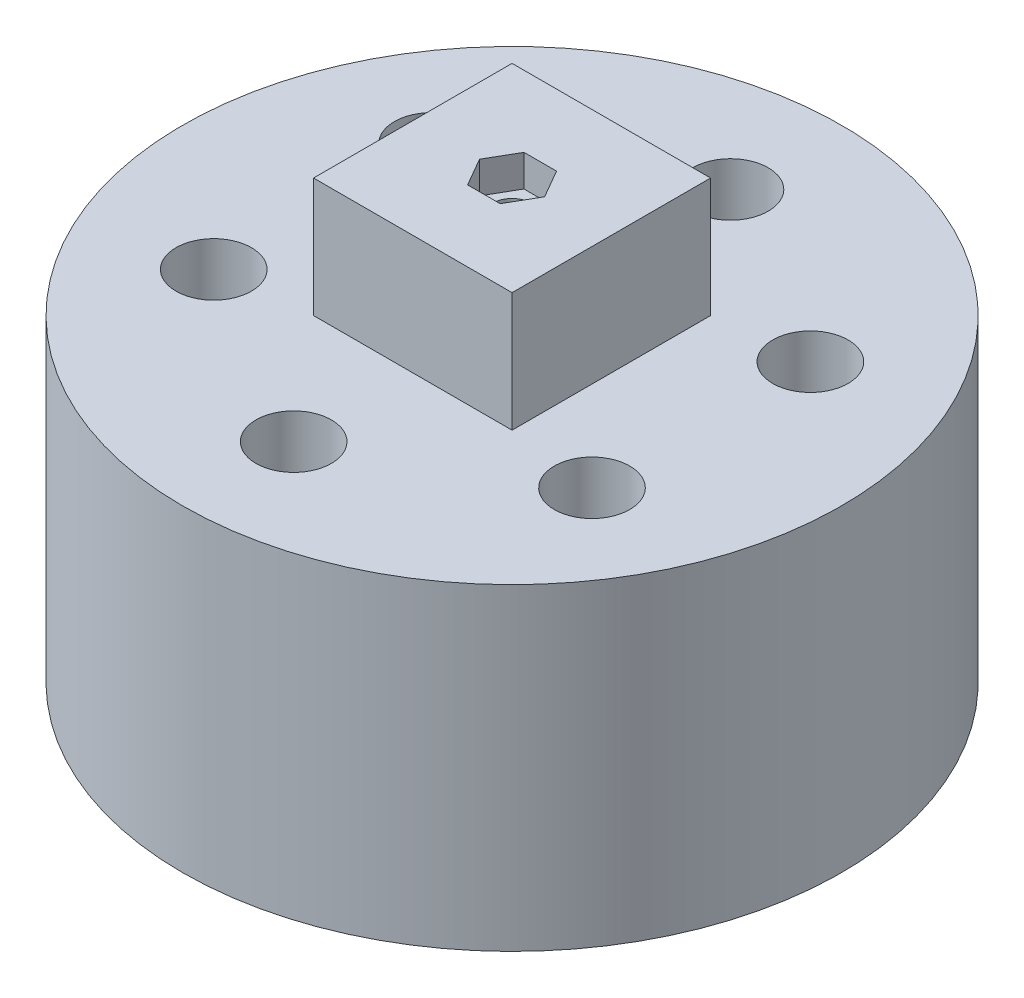
from build123d import *

# Parameters (mm, degrees)
SKETCH1_R             = 41.5
MAIN_PLATE_DEPTH      = 40
SKETCH2_R             = 2.05
CUT_EXTRUDE_G27_DEPTH = 72.024643611
SKETCH5_R             = 4.75
G27_SCREW_HEADS_DEPTH = 37
SKETCH6_W             = 25
SKETCH6_H             = 25
BOSS_EXTRUDE1_DEPTH   = 15
SKETCH8_R             = 4.5
CUT_EXTRUDE1_DEPTH    = 45
SKETCH10_R            = 2.5
CUT_EXTRUDE3_DEPTH    = 81.4332021
CUT_EXTRUDE4_DEPTH    = 4


with BuildPart() as part:
    # Sketch1 → Main Plate (new body)
    with BuildSketch(Plane(origin=(0, 0, 0), x_dir=(1, 0, 0), z_dir=(0, 1, 0))):
        with Locations(Location((0, 0, 0), (0, 0, 270))):
            Circle(SKETCH1_R)
    extrude(amount=MAIN_PLATE_DEPTH)

    # Sketch2 → Cut-Extrude G27 (cut, through all)
    with BuildSketch(Plane(origin=(0, 40, 0), x_dir=(1, 0, 0), z_dir=(0, 1, 0))):
        with Locations(Location((0, 27.5, 0), (0, 0, 270))):
            Circle(SKETCH2_R)
        with Locations(Location((23.815698604, 13.75, 0), (0, 0, 270))):
            Circle(SKETCH2_R)
        with Locations(Location((23.815698604, -13.75, 0), (0, 0, 270))):
            Circle(SKETCH2_R)
        with Locations(Location((0, -27.5, 0), (0, 0, 270))):
            Circle(SKETCH2_R)
        with Locations(Location((-23.815698604, -13.75, 0), (0, 0, 270))):
            Circle(SKETCH2_R)
        with Locations(Location((-23.815698604, 13.75, 0), (0, 0, 270))):
            Circle(SKETCH2_R)
    extrude(amount=-CUT_EXTRUDE_G27_DEPTH, mode=Mode.SUBTRACT)

    # Sketch5 → G27 Screw Heads (cut)
    with BuildSketch(Plane(origin=(0, 40, 0), x_dir=(1, 0, 0), z_dir=(0, 1, 0))):
        with Locations(Location((0, 27.5, 0), (0, 0, 270))):
            Circle(SKETCH5_R)
        with Locations(Location((23.815698604, 13.75, 0), (0, 0, 270))):
            Circle(SKETCH5_R)
        with Locations(Location((23.815698604, -13.75, 0), (0, 0, 270))):
            Circle(SKETCH5_R)
        with Locations(Location((0, -27.5, 0), (0, 0, 270))):
            Circle(SKETCH5_R)
        with Locations(Location((-23.815698604, -13.75, 0), (0, 0, 270))):
            Circle(SKETCH5_R)
        with Locations(Location((-23.815698604, 13.75, 0), (0, 0, 270))):
            Circle(SKETCH5_R)
    extrude(amount=-G27_SCREW_HEADS_DEPTH, mode=Mode.SUBTRACT)

    # Sketch6 → Boss-Extrude1 (add)
    with BuildSketch(Plane(origin=(0, 40, 0), x_dir=(1, 0, 0), z_dir=(0, 1, 0))):
        Rectangle(SKETCH6_W, SKETCH6_H)
    extrude(amount=BOSS_EXTRUDE1_DEPTH)

    # Sketch8 → Cut-Extrude1 (cut)
    with BuildSketch(Plane.XZ):
        with Locations(Location((0, 0, 0), (0, 0, 270))):
            Circle(SKETCH8_R)
    extrude(amount=-CUT_EXTRUDE1_DEPTH, mode=Mode.SUBTRACT)

    # Cut-Extrude2 cone 1 section (through the dimple's axis) → Cut-Extrude2 (revolve, cut)
    with BuildSketch(Plane(origin=(0, 45, 0), x_dir=(0, 0, -1), z_dir=(1, 0, 0))):
        Polygon((0, 0), (4.5, 0), (0, 4.5), align=None)
    revolve(axis=Axis((0, 45, 0), (0, 1, 0)), mode=Mode.SUBTRACT)

    # Sketch10 → Cut-Extrude3 (cut, through all)
    with BuildSketch(Plane(origin=(0, 55, 0), x_dir=(1, 0, 0), z_dir=(0, 1, 0))):
        with Locations(Location((0, 0, 0), (0, 0, 270))):
            Circle(SKETCH10_R)
    extrude(amount=-CUT_EXTRUDE3_DEPTH, mode=Mode.SUBTRACT)

    # Sketch11 → Cut-Extrude4 (cut)
    with BuildSketch(Plane(origin=(0, 55, 0), x_dir=(1, 0, 0), z_dir=(0, 1, 0))):
        Polygon((-4.099186911, 0), (-2.049593456, -3.55), (2.049593456, -3.55), (4.099186911, 0), (2.049593456, 3.55), (-2.049593456, 3.55), align=None)
    extrude(amount=-CUT_EXTRUDE4_DEPTH, mode=Mode.SUBTRACT)


solid = part.part
